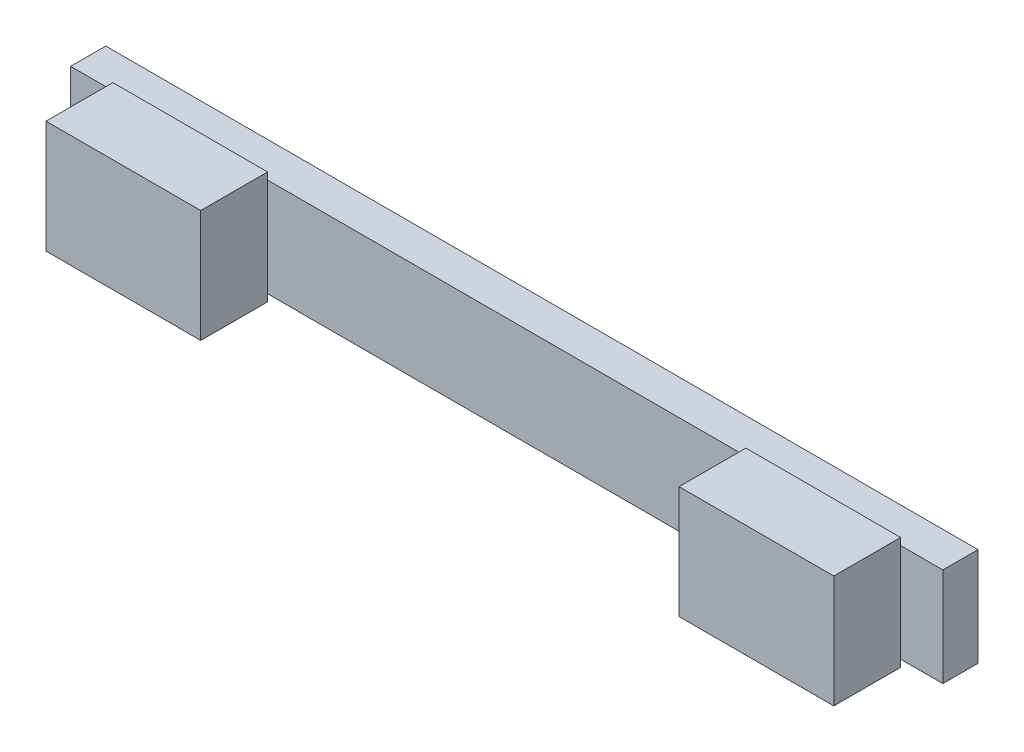
from build123d import *

# Parameters (mm, degrees)
EXTRUDE_START      = -356
EXTRUDE_SKETCH_1_W = 124
EXTRUDE_SKETCH_1_H = 14
EXTRUDE_1_DEPTH    = 5
EXTRUDE_START_2    = -351
EXTRUDE_SKETCH_2_W = 22
EXTRUDE_SKETCH_2_H = 16
EXTRUDE_2_DEPTH    = 9.5
EXTRUDE_SKETCH_3_W = 22
EXTRUDE_SKETCH_3_H = 16
EXTRUDE_3_DEPTH    = 9.5


with BuildPart() as part:
    # Extrude sketch 1 → Extrude 1 (new body)
    with BuildSketch(Plane.XY.offset(EXTRUDE_START)):
        with Locations((240, 0)):
            Rectangle(EXTRUDE_SKETCH_1_W, EXTRUDE_SKETCH_1_H)
    extrude(amount=EXTRUDE_1_DEPTH)


with BuildPart() as body_2:
    # Extrude sketch 2 → Extrude 2 (new body)
    with BuildSketch(Plane.XY.offset(EXTRUDE_START_2)):
        with Locations((285, 0)):
            Rectangle(EXTRUDE_SKETCH_2_W, EXTRUDE_SKETCH_2_H)
    extrude(amount=EXTRUDE_2_DEPTH)


with BuildPart() as body_3:
    # Extrude sketch 3 → Extrude 3 (new body)
    with BuildSketch(Plane.XY.offset(EXTRUDE_START_2)):
        with Locations((195, 0)):
            Rectangle(EXTRUDE_SKETCH_3_W, EXTRUDE_SKETCH_3_H)
    extrude(amount=EXTRUDE_3_DEPTH)


with BuildPart() as part_1:
    add(part.part)

    # Combine (weld / assembly of features): union body 2, body 3
    add(body_2.part)
    add(body_3.part)


solid = part_1.part
